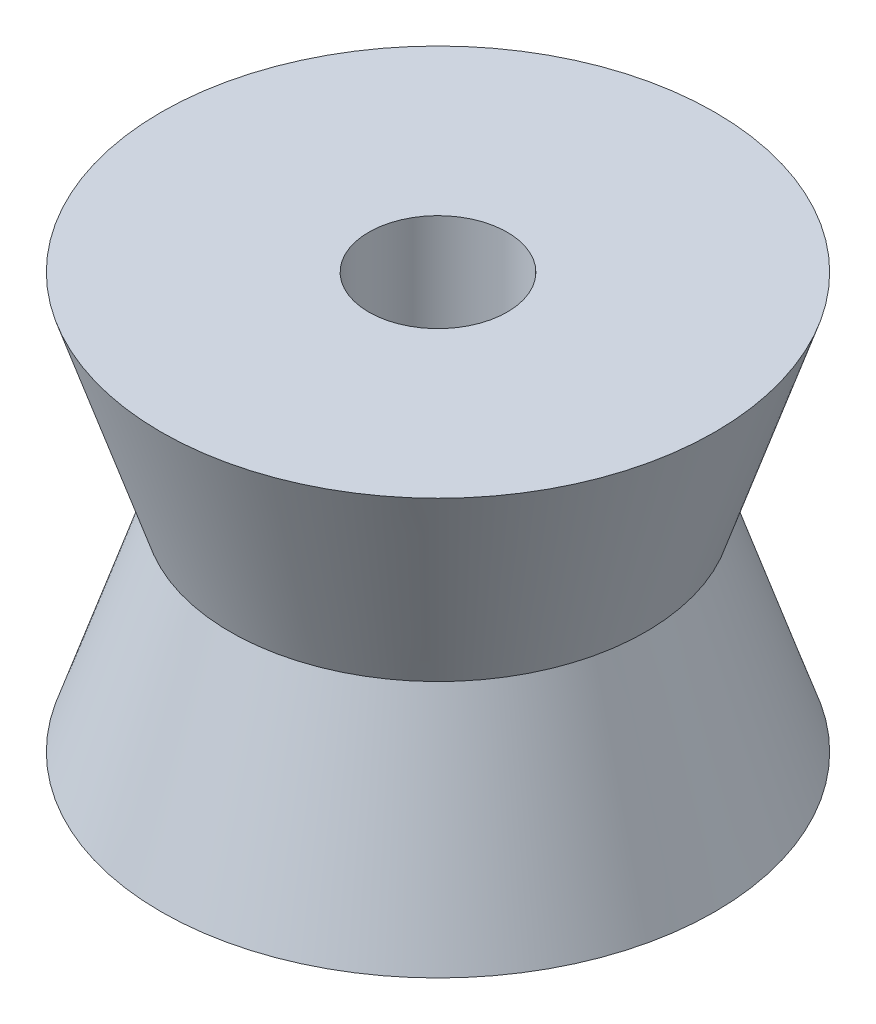
from build123d import *

# Parameters (mm, degrees)
SKETCH2_R          = 5
CUT_EXTRUDE1_DEPTH = 42.231056256


with BuildPart() as part:
    # Sketch1 → Revolve1 (revolve)
    with BuildSketch(Plane.XY, mode=Mode.PRIVATE) as revolve1_sk:
        Polygon((-20, 30), (-15, 15), (-20, 0), (0, 0), (0, 30), align=None)
    revolve(revolve1_sk.sketch.rotate(Axis((0, 0, 0), (0, 1, 0)), 270), axis=Axis((0, 0, 0), (0, 1, 0)))

    # Sketch2 → Cut-Extrude1 (cut, through all)
    with BuildSketch(Plane(origin=(0, 30, 0), x_dir=(1, 0, 0), z_dir=(0, 1, 0))):
        with Locations(Location((0, 0, 0), (0, 0, 270))):
            Circle(SKETCH2_R)
    extrude(amount=-CUT_EXTRUDE1_DEPTH, mode=Mode.SUBTRACT)


solid = part.part
